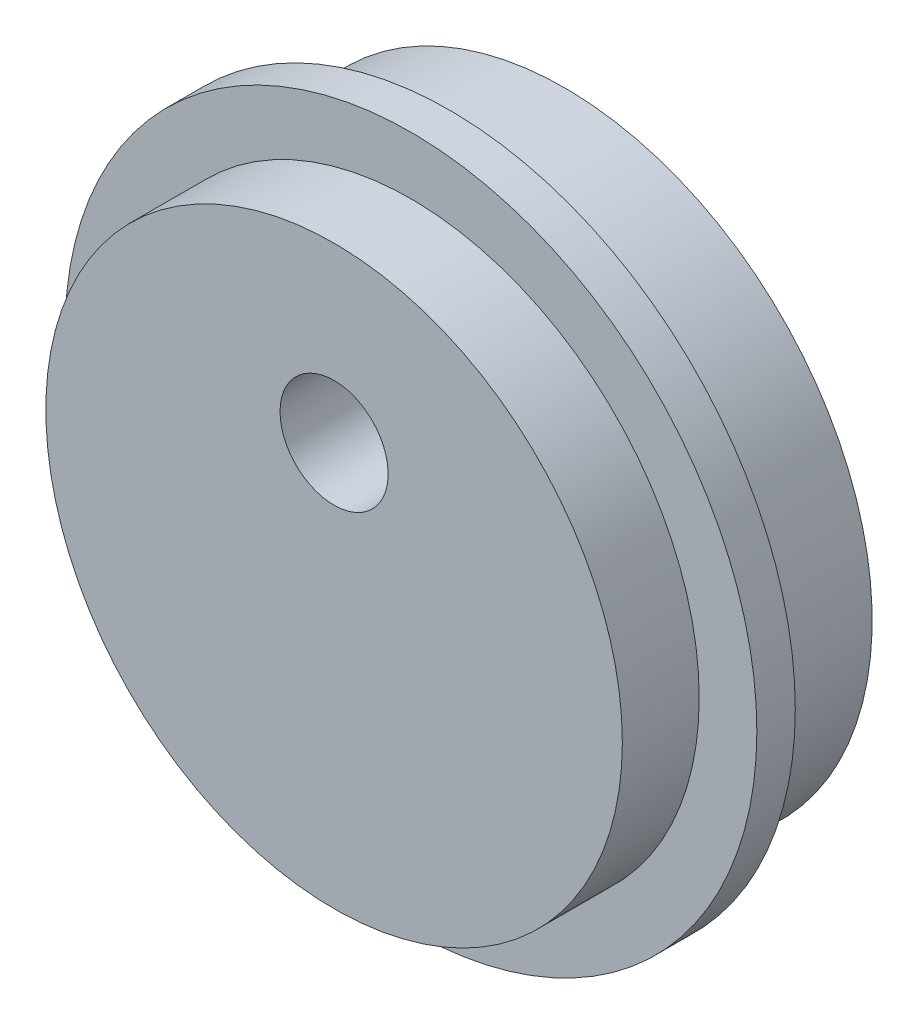
from build123d import *

# Parameters (mm, degrees)
SKETCH1_R               = 50.8
BOSS_EXTRUDE1_DEPTH     = 38.1
CUT_EXTRUDE_THIN2_START = -12.7
SKETCH22_R              = 50.8
SKETCH22_R_2            = 47.625
CUT_EXTRUDE_THIN2_DEPTH = 12.7
SKETCH24_R              = 57.15
BOSS_EXTRUDE3_DEPTH     = 6.35
CUT_EXTRUDE5_DEPTH      = 90.352420225
CUT_EXTRUDE5_DEPTH_BACK = 90.352420225
SKETCH20_R              = 8.9296875


with BuildPart() as part:
    # Sketch1 → Boss-Extrude1 (new body)
    with BuildSketch(Plane.XY):
        with Locations(Location((0, 0, 0), (0, 0, 180))):
            Circle(SKETCH1_R)
    extrude(amount=BOSS_EXTRUDE1_DEPTH)

    # Sketch22 → Cut-Extrude-Thin2 (cut)
    with BuildSketch(Plane.XY.offset(38.1).offset(CUT_EXTRUDE_THIN2_START)):
        Circle(SKETCH22_R)
        Circle(SKETCH22_R_2, mode=Mode.SUBTRACT)
    extrude(amount=CUT_EXTRUDE_THIN2_DEPTH, mode=Mode.SUBTRACT)

    # Sketch24 → Boss-Extrude3 (add)
    with BuildSketch(Plane.XY.offset(25.4)):
        Circle(SKETCH24_R)
    extrude(amount=-BOSS_EXTRUDE3_DEPTH)

    # Sketch20 → Cut-Extrude5 (cut, two sides: drawn at the far end of the back side and taken through both)
    with BuildSketch(Plane(origin=(0, 0, 0), x_dir=(-1, 0, 0), z_dir=(0, 0, -1)).offset(-CUT_EXTRUDE5_DEPTH_BACK)):
        with Locations((0, 19.05)):
            Circle(SKETCH20_R)
    extrude(amount=CUT_EXTRUDE5_DEPTH + CUT_EXTRUDE5_DEPTH_BACK, mode=Mode.SUBTRACT)


solid = part.part
